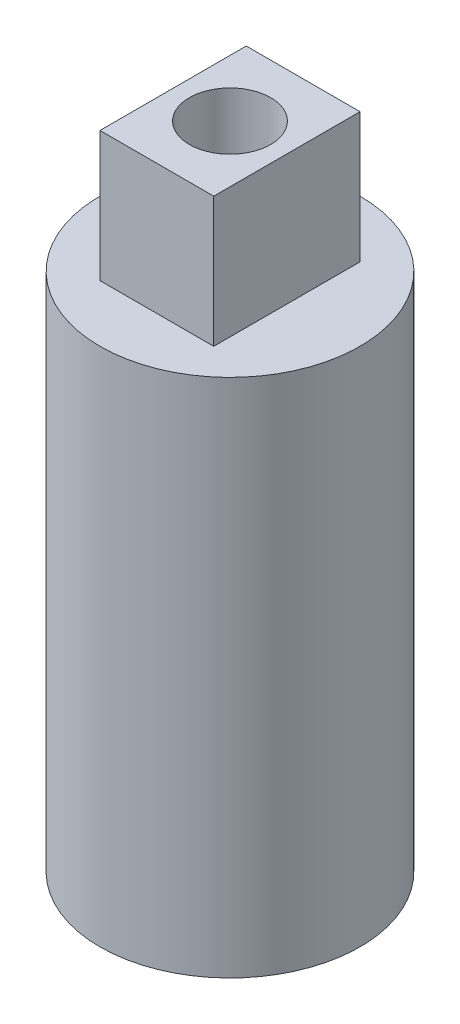
from build123d import *

# Parameters (mm, degrees)
SKETCH_1_R          = 40
EXTRUDE_1_DEPTH     = 160
SKETCH_2_W          = 35
SKETCH_2_H          = 45
EXTRUDE_2_DEPTH     = 40
SKETCH_7_R          = 12.5
CUT_EXTRUDE_2_DEPTH = 208.846096908
SHELL_1_T           = -1


with BuildPart() as part:
    # Эскиз1 → Бобышка-Вытянуть1 (new body)
    with BuildSketch(Plane(origin=(0, 0, 0), x_dir=(1, 0, 0), z_dir=(0, 1, 0))):
        with Locations(Location((0, 0, 0), (0, 0, 270))):
            Circle(SKETCH_1_R)
    extrude(amount=EXTRUDE_1_DEPTH)

    # Эскиз2 → Бобышка-Вытянуть2 (add)
    with BuildSketch(Plane(origin=(0, 160, 0), x_dir=(1, 0, 0), z_dir=(0, 1, 0))):
        Rectangle(SKETCH_2_W, SKETCH_2_H)
    extrude(amount=EXTRUDE_2_DEPTH)

    # Эскиз7 → Вырез-Вытянуть2 (cut, through all)
    with BuildSketch(Plane(origin=(0, 200, 0), x_dir=(1, 0, 0), z_dir=(0, 1, 0))):
        with Locations(Location((0, 0, 0), (0, 0, 270))):
            Circle(SKETCH_7_R)
    extrude(amount=-CUT_EXTRUDE_2_DEPTH, mode=Mode.SUBTRACT)

    # Оболочка1
    shell_1_openings = [part.faces().sort_by_distance(p)[0] for p in [
        (0, 0, -38.86862915),
    ]]
    offset(amount=SHELL_1_T, openings=shell_1_openings, kind=Kind.INTERSECTION)


solid = part.part
